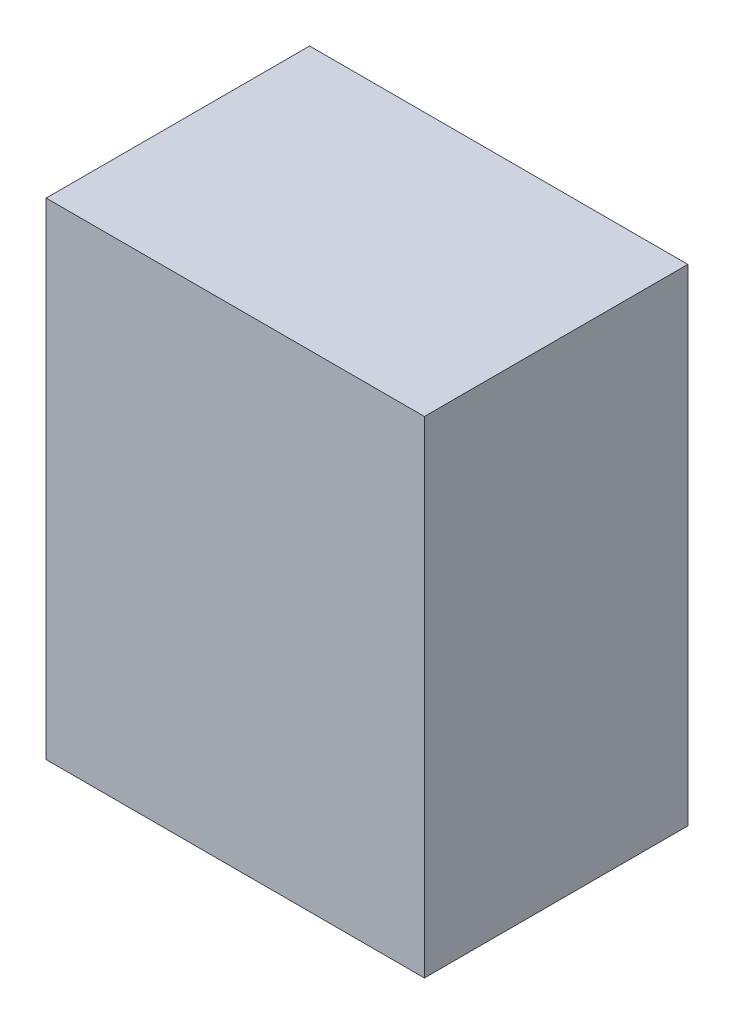
from build123d import *

# Parameters (mm, degrees)
SKETCH_1_W      = 56
SKETCH_1_H      = 72
EXTRUDE_1_DEPTH = 39


with BuildPart() as part:
    # 草图1 → 凸台-拉伸1 (new body)
    with BuildSketch(Plane.XY):
        Rectangle(SKETCH_1_W, SKETCH_1_H)
    extrude(amount=EXTRUDE_1_DEPTH)


solid = part.part
